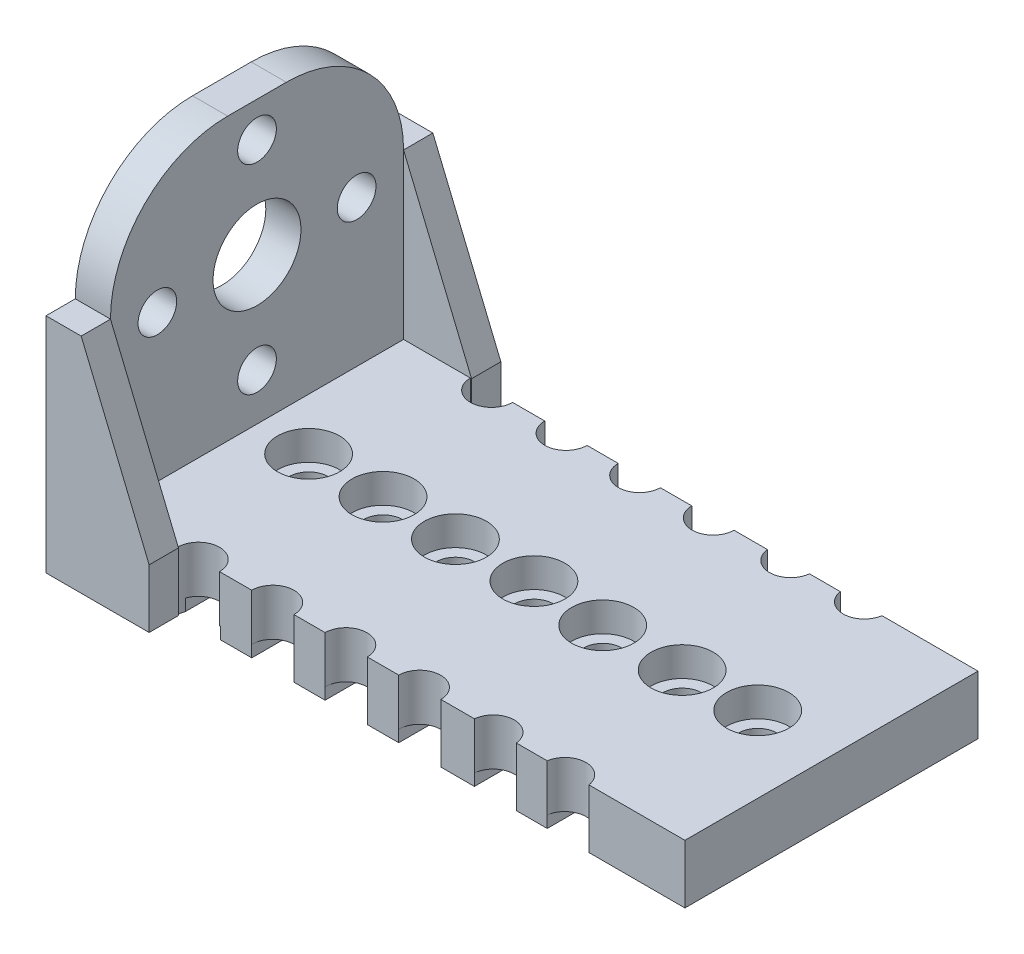
from build123d import *

# Parameters (mm, degrees)
ESBO_O1_W                = 3
ESBO_O1_H                = 25
RESSALTO_EXTRUS_O2_DEPTH = 29
ESBO_O1_4_W              = 49
ESBO_O1_4_H              = 25
RESSALTO_EXTRUS_O3_DEPTH = 5
FILETE2_R                = 10
FILETE3_R                = 10
ESBO_O8_R                = 1.65
CORTE_EXTRUS_O5_DEPTH    = 5
ESBO_O9_R                = 1.8
CORTE_EXTRUS_O6_DEPTH    = 5
ESBO_O10_W               = 3.6
ESBO_O10_H               = 25
ESBO_O10_W_2             = 3.599774239
ESBO_O10_W_3             = 3.58084234
ESBO_O10_W_4             = 3.559844881
CORTE_EXTRUS_O7_DEPTH    = 1
ESBO_O11_R               = 2.65
CORTE_EXTRUS_O8_DEPTH    = 2.5
ESBO_O6_R                = 3.75
ESBO_O6_R_2              = 1.65
CORTE_EXTRUS_O9_DEPTH    = 10
RESSALTO_EXTRUS_O4_DEPTH = 2.5
RESSALTO_EXTRUS_O5_DEPTH = 2.5


with BuildPart() as part:
    # Esboço1 → Ressalto-extrusão2 (new body)
    with BuildSketch(Plane(origin=(0, 0, 0), x_dir=(1, 0, 0), z_dir=(0, 1, 0))):
        with Locations((-24.963414634, 1.243902439)):
            Rectangle(ESBO_O1_W, ESBO_O1_H)
    extrude(amount=RESSALTO_EXTRUS_O2_DEPTH)

    # Esboço1<4> → Ressalto-extrusão3 (add)
    with BuildSketch(Plane(origin=(0, 0, 0), x_dir=(1, 0, 0), z_dir=(0, 1, 0))):
        with Locations((1.036585366, 1.243902439)):
            Rectangle(ESBO_O1_4_W, ESBO_O1_4_H)
    extrude(amount=RESSALTO_EXTRUS_O3_DEPTH)

    # Filete2
    filete2_edges = [part.edges().sort_by_distance(p)[0] for p in [
        (-24.963414634, 29, -13.743902439),
    ]]
    fillet(filete2_edges, radius=FILETE2_R)

    # Filete3
    filete3_edges = [part.edges().sort_by_distance(p)[0] for p in [
        (-24.963414634, 29, 11.256097561),
    ]]
    fillet(filete3_edges, radius=FILETE3_R)

    # Esboço8 → Corte-extrusão5 (cut)
    with BuildSketch(Plane(origin=(0, 5, 0), x_dir=(1, 0, 0), z_dir=(0, 1, 0))):
        with Locations((-19.063414634, 1.243902439)):
            Circle(ESBO_O8_R)
        with Locations((-12.713414634, 1.243902439)):
            Circle(ESBO_O8_R)
        with Locations((-6.497326215, 1.203335799)):
            Circle(ESBO_O8_R)
        with Locations((-0.050914634, 1.451274706)):
            Circle(ESBO_O8_R)
        with Locations((6.147558039, 1.120689497)):
            Circle(ESBO_O8_R)
        with Locations((12.841908527, 1.203335799)):
            Circle(ESBO_O8_R)
        with Locations((19.040381201, 1.451274706)):
            Circle(ESBO_O8_R)
    extrude(amount=-CORTE_EXTRUS_O5_DEPTH, mode=Mode.SUBTRACT)

    # Esboço9 → Corte-extrusão6 (cut)
    with BuildSketch(Plane.XZ):
        with Locations((-15.963414634, 11.256097561)):
            Circle(ESBO_O9_R)
        with Locations((-9.613414634, 11.256097561)):
            Circle(ESBO_O9_R)
        with Locations((-3.356766727, 11.27625585)):
            Circle(ESBO_O9_R)
        with Locations((2.924352249, 11.27625585)):
            Circle(ESBO_O9_R)
        with Locations((9.37076383, 11.441548455)):
            Circle(ESBO_O9_R)
        with Locations((15.569236503, 11.524194757)):
            Circle(ESBO_O9_R)
        with Locations((15.569236503, -14.011999635)):
            Circle(ESBO_O9_R)
        with Locations((9.37076383, -13.929353333)):
            Circle(ESBO_O9_R)
        with Locations((2.924352249, -13.764060728)):
            Circle(ESBO_O9_R)
        with Locations((-3.356766727, -13.764060728)):
            Circle(ESBO_O9_R)
        with Locations((-9.613414634, -13.743902439)):
            Circle(ESBO_O9_R)
        with Locations((-15.963414634, -13.743902439)):
            Circle(ESBO_O9_R)
    extrude(amount=-CORTE_EXTRUS_O6_DEPTH, mode=Mode.SUBTRACT)

    # Esboço10 → Corte-extrusão7 (cut)
    with BuildSketch(Plane.XZ):
        with Locations((-15.863414634, -1.243902439)):
            Rectangle(ESBO_O10_W, ESBO_O10_H)
        with Locations((-9.613414634, -1.243902439)):
            Rectangle(ESBO_O10_W, ESBO_O10_H)
        with Locations((-3.356766727, -1.243902439)):
            Rectangle(ESBO_O10_W_2, ESBO_O10_H)
        with Locations((2.92435225, -1.243902439)):
            Rectangle(ESBO_O10_W_2, ESBO_O10_H)
        with Locations((9.37076383, -1.243902439)):
            Rectangle(ESBO_O10_W_3, ESBO_O10_H)
        with Locations((15.569236504, -1.243902439)):
            Rectangle(ESBO_O10_W_4, ESBO_O10_H)
    extrude(amount=-CORTE_EXTRUS_O7_DEPTH, mode=Mode.SUBTRACT)

    # Esboço11 → Corte-extrusão8 (cut)
    with BuildSketch(Plane(origin=(0, 5, 0), x_dir=(1, 0, 0), z_dir=(0, 1, 0))):
        with Locations((-19.063414634, 1.243902439)):
            Circle(ESBO_O11_R)
        with Locations((-12.713414634, 1.243902439)):
            Circle(ESBO_O11_R)
        with Locations((-6.497326215, 1.203335799)):
            Circle(ESBO_O11_R)
        with Locations((-0.050914634, 1.451274706)):
            Circle(ESBO_O11_R)
        with Locations((6.147558039, 1.120689497)):
            Circle(ESBO_O11_R)
        with Locations((12.841908527, 1.203335799)):
            Circle(ESBO_O11_R)
        with Locations((19.040381201, 1.451274706)):
            Circle(ESBO_O11_R)
    extrude(amount=-CORTE_EXTRUS_O8_DEPTH, mode=Mode.SUBTRACT)

    # Esboço6 → Corte-extrusão9 (cut)
    with BuildSketch(Plane(origin=(-23.463414634, 0, 0), x_dir=(0, 0, -1), z_dir=(1, 0, 0))):
        with Locations((1.243902439, 17.5)):
            Circle(ESBO_O6_R)
        with Locations((9.743902439, 17.5)):
            Circle(ESBO_O6_R_2)
        with Locations((-7.256097561, 17.5)):
            Circle(ESBO_O6_R_2)
        with Locations((1.243902439, 26)):
            Circle(ESBO_O6_R_2)
        with Locations((1.243902439, 9)):
            Circle(ESBO_O6_R_2)
    extrude(amount=-CORTE_EXTRUS_O9_DEPTH, mode=Mode.SUBTRACT)

    # Esboço29 → Ressalto-extrusão4 (add)
    with BuildSketch(Plane.XY.offset(11.256097561)):
        Polygon((-23.463414634, 19), (-17.663414634, 5), (-17.663414634, 0), (-26.463414634, 0), (-26.463414634, 19), align=None)
    extrude(amount=RESSALTO_EXTRUS_O4_DEPTH)

    # Esboço30 → Ressalto-extrusão5 (add)
    with BuildSketch(Plane(origin=(0, 0, -13.743902439), x_dir=(-1, 0, 0), z_dir=(0, 0, -1))):
        Polygon((23.463414634, 19), (17.663414634, 5), (17.663414634, 0), (26.463414634, 0), (26.463414634, 19), align=None)
    extrude(amount=RESSALTO_EXTRUS_O5_DEPTH)


solid = part.part
